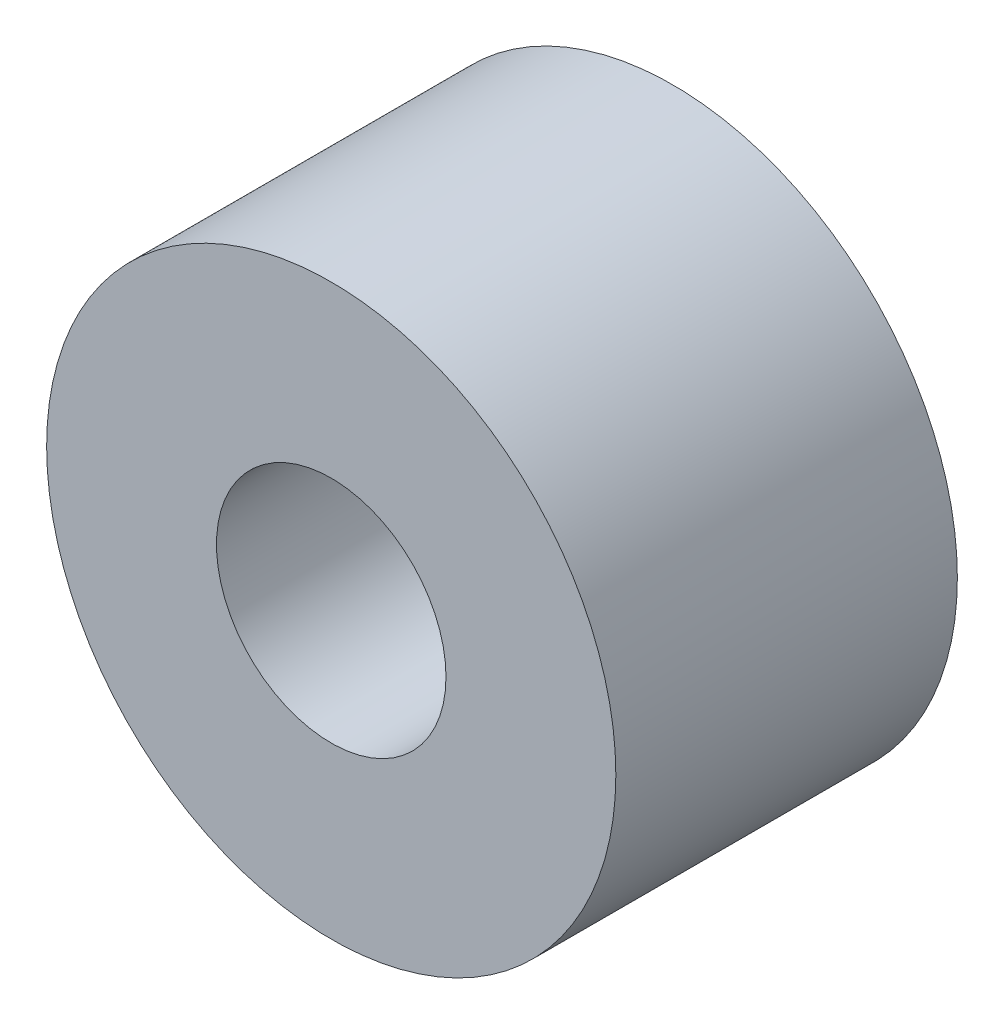
from build123d import *

# Parameters (mm, degrees)
SKETCH1_R      = 7.9375
SKETCH1_R_2    = 3.2004
EXTRUDE1_DEPTH = 4.7625


with BuildPart() as part:
    # Sketch1 → Extrude1 (new, symmetric)
    with BuildSketch(Plane.XY):
        Circle(SKETCH1_R)
        Circle(SKETCH1_R_2, mode=Mode.SUBTRACT)
    extrude(amount=EXTRUDE1_DEPTH, both=True)


solid = part.part
